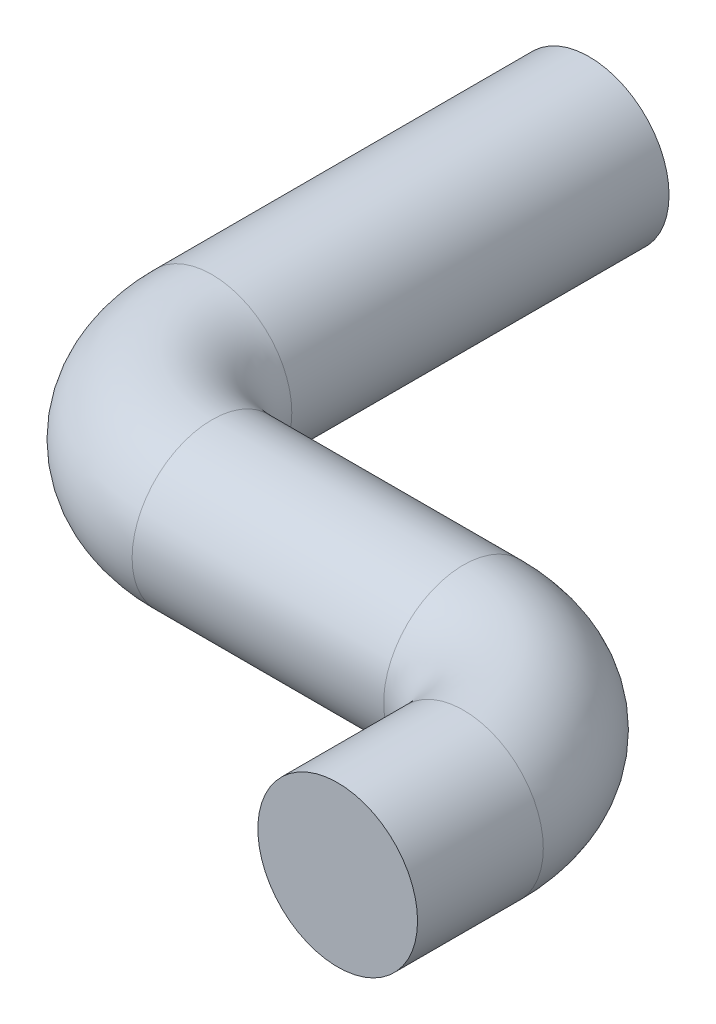
from build123d import *

# Parameters (mm, degrees)
CROQUIS2_R = 6.35


with BuildPart() as part:
    # Barrer1: sweep along a path in Croquis1
    with BuildLine(Plane(origin=(0, 0, 0), x_dir=(1, 0, 0), z_dir=(0, 1, 0))) as barrer1_path:
        Line((0, 0), (0, -30))
        ThreePointArc((0, -30), (2.928932188, -37.071067812), (10, -40))
        Line((10, -40), (30, -40))
        ThreePointArc((30, -40), (37.071067812, -42.928932188), (40, -50))
        Line((40, -50), (40, -60))
    # Croquis2 → Barrer1 (sweep)
    with BuildSketch(Plane.XY):
        Circle(CROQUIS2_R)
    sweep(path=barrer1_path.line)


solid = part.part
